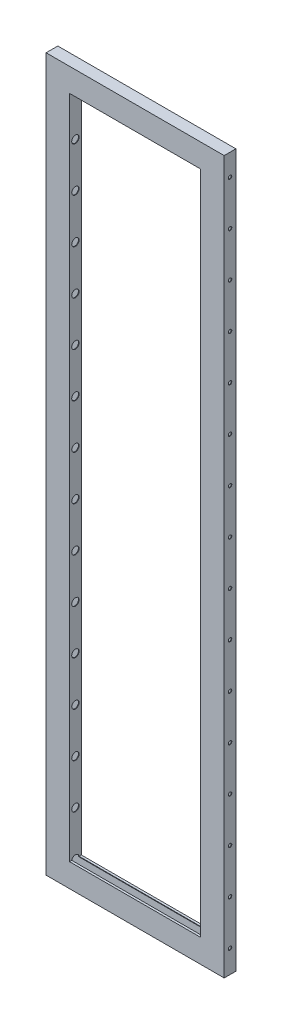
from build123d import *

# Parameters (mm, degrees)
SKETCH2_W          = 80
SKETCH2_H          = 40
SKETCH2_W_2        = 76
SKETCH2_H_2        = 36
CUT_EXTRUDE1_START = -10
SKETCH3_R          = 12.5
CUT_EXTRUDE1_DEPTH = 510
LPATTERN1_COUNT    = 16
LPATTERN1_PITCH    = 152
SKETCH4_R          = 6
CUT_EXTRUDE2_DEPTH = 10
LPATTERN2_COUNT    = 16
LPATTERN2_PITCH    = 152


with BuildPart() as part:
    # Sweep-Thin1: sweep along a path in Sketch1
    with BuildLine(Plane.XY) as sweep_thin1_path:
        Line((304, -1216), (-304, -1216))
        Line((-304, -1216), (-304, 1216))
        Line((-304, 1216), (304, 1216))
        Line((304, 1216), (304, -1216))
    # Sketch2 → Sweep-Thin1 (sweep)
    with BuildSketch(Plane(origin=(0, 0, 0), x_dir=(1, 0, 0), z_dir=(0, 1, 0))):
        with Locations((-264, 0)):
            Rectangle(SKETCH2_W, SKETCH2_H)
        with Locations((-264, 0)):
            Rectangle(SKETCH2_W_2, SKETCH2_H_2, mode=Mode.SUBTRACT)
    sweep(path=sweep_thin1_path.line, transition=Transition.RIGHT)

    # Sketch3 → Cut-Extrude1 (cut)
    with BuildSketch(Plane.ZY.offset(-224).offset(CUT_EXTRUDE1_START)):
        with Locations((0, 1142)):
            Circle(SKETCH3_R)
    cut_extrude1 = extrude(amount=CUT_EXTRUDE1_DEPTH, mode=Mode.SUBTRACT)

    # LPattern1: Cut-Extrude1 ×16
    with Locations(*[(0, -i * LPATTERN1_PITCH, 0) for i in range(1, LPATTERN1_COUNT)]):
        add(cut_extrude1, mode=Mode.SUBTRACT)

    # Sketch4 → Cut-Extrude2 (cut)
    with BuildSketch(Plane(origin=(304, 0, 0), x_dir=(0, 0, -1), z_dir=(1, 0, 0))):
        with Locations((0, 1142)):
            Circle(SKETCH4_R)
    cut_extrude2 = extrude(amount=-CUT_EXTRUDE2_DEPTH, mode=Mode.SUBTRACT)

    # LPattern2: Cut-Extrude2 ×16
    with Locations(*[(0, -i * LPATTERN2_PITCH, 0) for i in range(1, LPATTERN2_COUNT)]):
        add(cut_extrude2, mode=Mode.SUBTRACT)


solid = part.part
